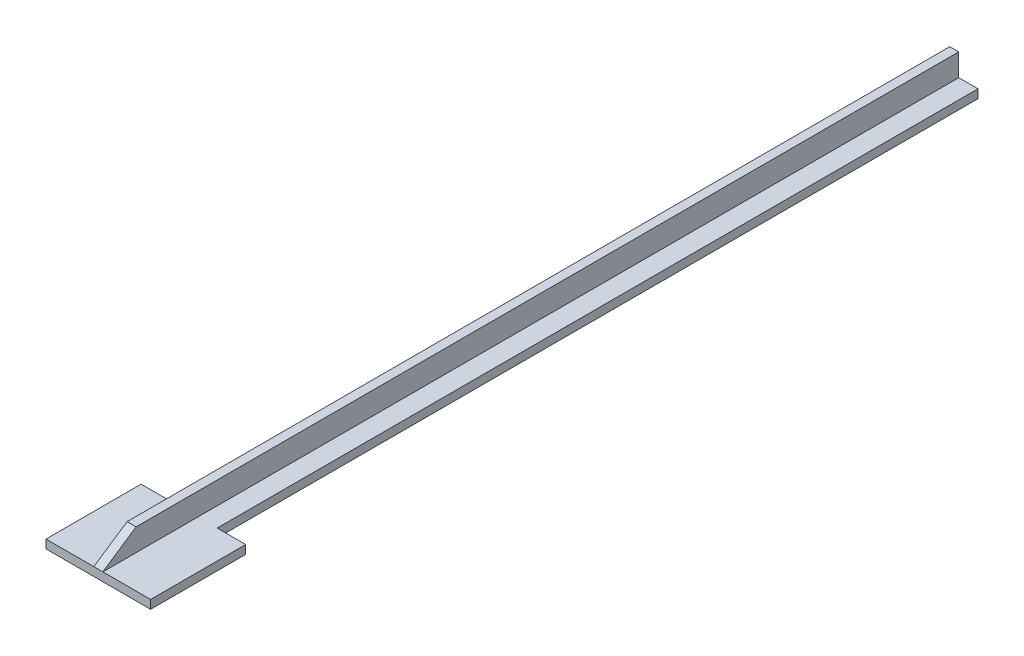
from build123d import *

# Parameters (mm, degrees)
SKETCH1_W           = 10
SKETCH1_H           = 1.8
SKETCH1_W_2         = 1.9
SKETCH1_H_2         = 4.7
BOSS_EXTRUDE1_DEPTH = 180
SKETCH2_W           = 22
SKETCH2_H           = 1.8
BOSS_EXTRUDE2_DEPTH = 20
CHAMFER1_SIZE       = 7
CHAMFER1_SIZE2      = 4.7


with BuildPart() as part:
    # Sketch1 → Boss-Extrude1 (new body)
    with BuildSketch(Plane.XY):
        with Locations((5, 0.9)):
            Rectangle(SKETCH1_W, SKETCH1_H)
        with Locations((5, 4.15)):
            Rectangle(SKETCH1_W_2, SKETCH1_H_2)
    extrude(amount=BOSS_EXTRUDE1_DEPTH)

    # Sketch2 → Boss-Extrude2 (add)
    with BuildSketch(Plane.XY.offset(180)):
        with Locations((5, 0.9)):
            Rectangle(SKETCH2_W, SKETCH2_H)
    extrude(amount=-BOSS_EXTRUDE2_DEPTH)

    # Chamfer1
    chamfer1_edges = [part.edges().sort_by_distance(p)[0] for p in [
        (5, 6.5, 180),
    ]]
    chamfer1_side = [part.faces().sort_by_distance(p)[0] for p in [
        (5, 6.5, 90),
    ]]
    chamfer(chamfer1_edges, length=CHAMFER1_SIZE, length2=CHAMFER1_SIZE2, reference=chamfer1_side[0])


solid = part.part
